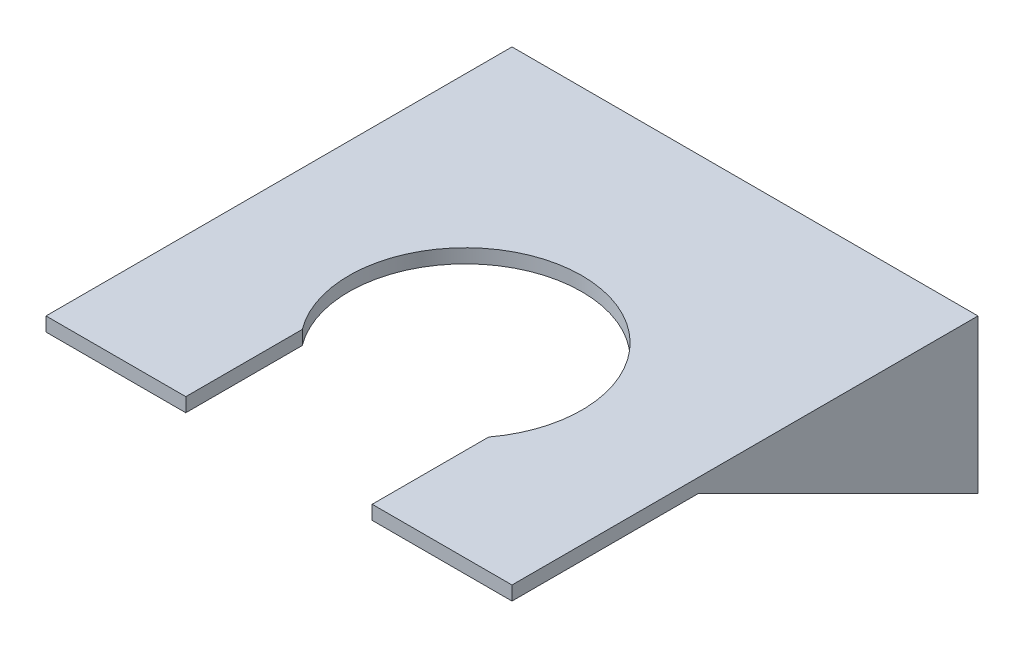
from build123d import *

# Parameters (mm, degrees)
SKETCH1_W           = 50
SKETCH1_H           = 1.5
BOSS_EXTRUDE1_DEPTH = 50
CUT_EXTRUDE1_DEPTH  = 1.5
BOSS_EXTRUDE2_DEPTH = 1.5


with BuildPart() as part:
    # Sketch1 → Boss-Extrude1 (new body)
    with BuildSketch(Plane.XY):
        with Locations((0, -1.811768481)):
            Rectangle(SKETCH1_W, SKETCH1_H)
    extrude(amount=BOSS_EXTRUDE1_DEPTH)

    # Sketch2 → Cut-Extrude1 (cut)
    with BuildSketch(Plane(origin=(0, -1.061768481, 0), x_dir=(1, 0, 0), z_dir=(0, 1, 0))):
        with BuildLine():
            Line((-10, -37.5), (-10, -50))
            Line((-10, -50), (10, -50))
            Line((10, -50), (10, -37.5))
            ThreePointArc((10, -37.5), (0, -17.5), (-10, -37.5))
        make_face()
    extrude(amount=-CUT_EXTRUDE1_DEPTH, mode=Mode.SUBTRACT)

    # Sketch4 → Boss-Extrude2 (add)
    with BuildSketch(Plane.ZY.offset(25)):
        Polygon((0, -2.561768481), (0, -17.561768481), (30, -2.561768481), align=None)
    boss_extrude2 = extrude(amount=-BOSS_EXTRUDE2_DEPTH)

    # Mirror1: Boss-Extrude2 across plane
    add(boss_extrude2.mirror(Plane(origin=(0, 0, 0), x_dir=(0, 0, 1), z_dir=(1, 0, 0))))


solid = part.part
